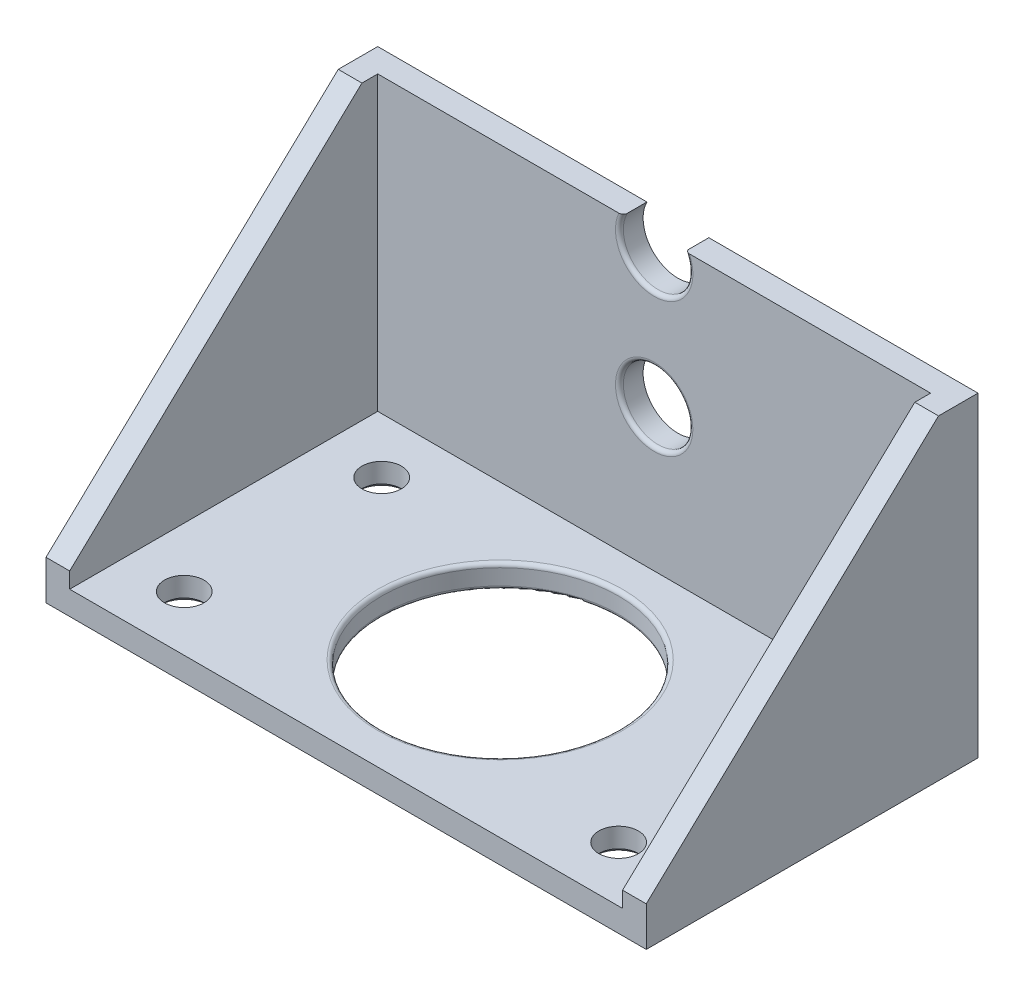
from build123d import *

# Parameters (mm, degrees)
EXTRUDE_1_DEPTH              = 3
SKETCH_2_W                   = 76
SKETCH_2_H                   = 3
EXTRUDE_2_DEPTH              = 39
CUT_EXTRUDE_1_DEPTH          = 52
CUT_EXTRUDE_2_DEPTH          = 52
EXTRUDE_3_DEPTH              = 3
HOLE_WIZARD_M6_2_D           = 5
HOLE_WIZARD_M6_2_CSINK_D     = 6.05
HOLE_WIZARD_M6_2_CSINK_ANGLE = 90
FILLET_4_R                   = 5
FILLET_5_R                   = 0.5
SKETCH_15_W                  = 76
SKETCH_15_H                  = 31.455270273
CUT_EXTRUDE_3_DEPTH          = 21


with BuildPart() as part:
    # 草图1 → 凸台-拉伸1 (new body)
    with BuildSketch(Plane.XY):
        Polygon((48, 70), (28, 70), (0, 40), (0, 0), (76, 0), (76, 40), align=None)
    extrude(amount=EXTRUDE_1_DEPTH)

    # 草图2 → 凸台-拉伸2 (add)
    with BuildSketch(Plane.XY.offset(3)):
        with Locations((38, 1.5)):
            Rectangle(SKETCH_2_W, SKETCH_2_H)
    extrude(amount=EXTRUDE_2_DEPTH)

    # 草图7 → 切除-拉伸1 (cut)
    with BuildSketch(Plane.XY.offset(3)):
        with BuildLine():
            ThreePointArc((42.4, 55), (41.111269837, 58.111269837), (38, 59.4))
            Line((38, 59.4), (38, 50.6))
            ThreePointArc((38, 50.6), (41.111269837, 51.888730163), (42.4, 55))
        make_face()
        with BuildLine():
            Line((38, 50.6), (38, 59.4))
            ThreePointArc((38, 59.4), (33.6, 55), (38, 50.6))
        make_face()
        with BuildLine():
            ThreePointArc((42.4, 38), (41.111269837, 41.111269837), (38, 42.4))
            Line((38, 42.4), (38, 33.6))
            ThreePointArc((38, 33.6), (41.111269837, 34.888730163), (42.4, 38))
        make_face()
        with BuildLine():
            Line((38, 33.6), (38, 42.4))
            ThreePointArc((38, 42.4), (33.6, 38), (38, 33.6))
        make_face()
        with BuildLine():
            ThreePointArc((42.4, 21), (41.111269837, 24.111269837), (38, 25.4))
            Line((38, 25.4), (38, 16.6))
            ThreePointArc((38, 16.6), (41.111269837, 17.888730163), (42.4, 21))
        make_face()
        with BuildLine():
            Line((38, 16.6), (38, 25.4))
            ThreePointArc((38, 25.4), (33.6, 21), (38, 16.6))
        make_face()
    extrude(amount=-CUT_EXTRUDE_1_DEPTH, mode=Mode.SUBTRACT)

    # 草图8 → 切除-拉伸2 (cut)
    with BuildSketch(Plane(origin=(0, 3, 0), x_dir=(1, 0, 0), z_dir=(0, 1, 0))):
        with BuildLine():
            ThreePointArc((23, -22.5), (38, -37.5), (53, -22.5))
            Line((53, -22.5), (23, -22.5))
        make_face()
        with BuildLine():
            Line((23, -22.5), (53, -22.5))
            ThreePointArc((53, -22.5), (38, -7.5), (23, -22.5))
        make_face()
    extrude(amount=-CUT_EXTRUDE_2_DEPTH, mode=Mode.SUBTRACT)

    # 草图10 → 凸台-拉伸3 (add)
    with BuildSketch(Plane.ZY):
        Polygon((3, 40), (5, 40), (42, 5), (42, 3), (3, 3), align=None)
    extrude_3 = extrude(amount=-EXTRUDE_3_DEPTH)

    # 镜向1: 凸台-拉伸3 across plane
    add(extrude_3.mirror(Plane(origin=(38, 0, 0), x_dir=(0, 0, 1), z_dir=(1, 0, 0))))

    # M6 螺纹孔2 (through all)
    with Locations(Plane(origin=(0, 0, 0), x_dir=(-1, 0, 0), z_dir=(0, -1, 0))):
        with Locations((-65.5, -10), (-10.5, -10), (-10.5, -35), (-65.5, -35)):
            CounterSinkHole(HOLE_WIZARD_M6_2_D / 2, HOLE_WIZARD_M6_2_CSINK_D / 2, counter_sink_angle=HOLE_WIZARD_M6_2_CSINK_ANGLE)

    # 圆角4
    fillet_4_edges = [part.edges().sort_by_distance(p)[0] for p in [
        (48, 70, 1.5),
        (28, 70, 1.5),
    ]]
    fillet(fillet_4_edges, radius=FILLET_4_R)

    # 圆角5
    fillet_5_edges = [part.edges().sort_by_distance(p)[0] for p in [
        (38, 50.6, 3),
        (38, 33.6, 3),
        (38, 16.6, 3),
        (23, 0, 22.5),
        (23, 3, 22.5),
    ]]
    fillet(fillet_5_edges, radius=FILLET_5_R)

    # 草图15 → 切除-拉伸3 (cut)
    with BuildSketch(Plane.XY.offset(3)):
        with Locations((38, 55.727635137)):
            Rectangle(SKETCH_15_W, SKETCH_15_H)
    extrude(amount=-CUT_EXTRUDE_3_DEPTH, mode=Mode.SUBTRACT)


solid = part.part
